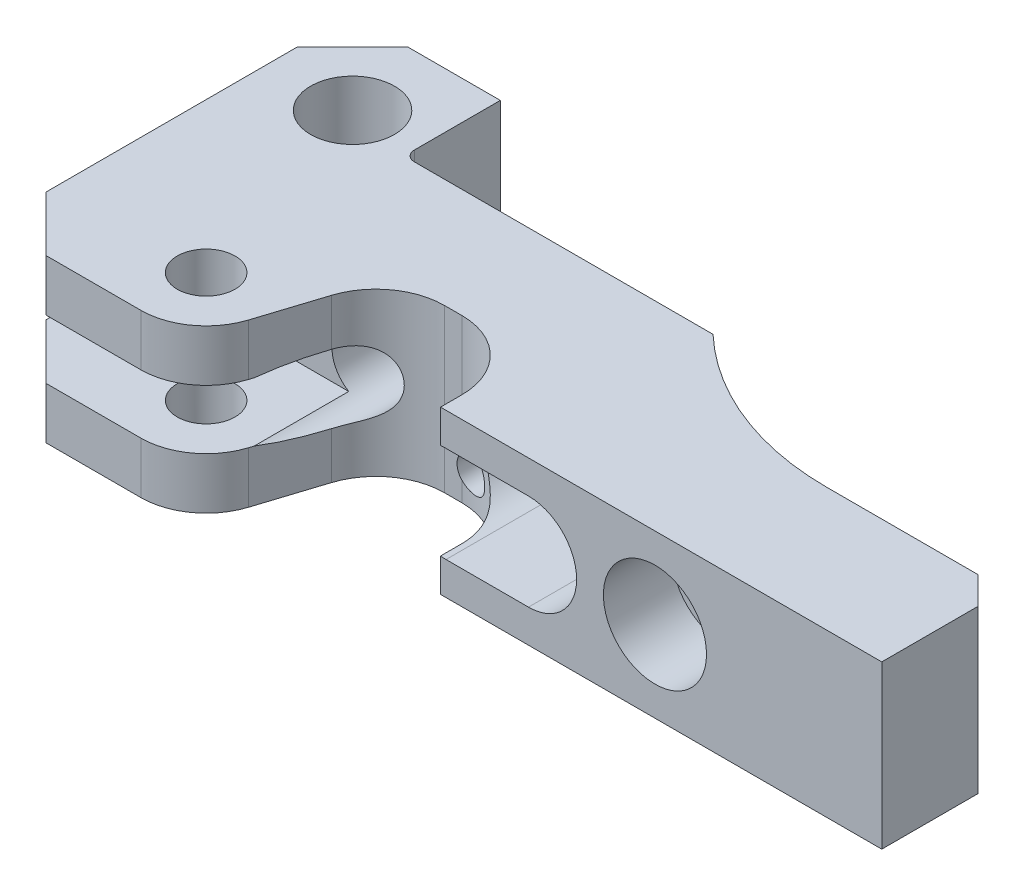
from build123d import *

# Parameters (mm, degrees)
CROQUIS1_R                 = 1.5
CROQUIS1_R_2               = 3.05
SALIENTE_EXTRUIR1_DEPTH    = 11.8
TALADRO_ROSCADO_M51_D      = 4.2
CROQUIS2_W                 = 10.5
CROQUIS2_H                 = 4.3
CORTAR_EXTRUIR1_DEPTH      = 18
CORTAR_EXTRUIR6_DEPTH      = 58.488085722
CORTAR_EXTRUIR6_DEPTH_BACK = 58.488085722
CROQUIS13_R                = 2.5
CROQUIS27_R                = 3.1
CORTAR_EXTRUIR8_DEPTH      = 10
CROQUIS31_R                = 3.75
CORTAR_EXTRUIR9_DEPTH      = 5
CORTAR_EXTRUIR12_DEPTH     = 59.884038604
CHAFL_N2_SIZE              = 4
CHAFL_N3_SIZE              = 2
CORTAR_EXTRUIR17_DEPTH     = 62.212172011
CROQUIS46_W                = 28.049554897
CROQUIS46_H                = 7
CORTAR_EXTRUIR18_DEPTH     = 59.884038604
TALADRO_ROSCADO_M31_D      = 2.5
TALADRO_ROSCADO_M31_DEPTH  = 8.5
REDONDEO2_R                = 0.75
CHAFL_N5_SIZE              = 0.6
CHAFL_N5_SIZE2             = 1.039230485
CHAFL_N6_SIZE              = 4


with BuildPart() as part:
    # Croquis1 → Saliente-Extruir1 (new body)
    with BuildSketch(Plane(origin=(0, 0, 0), x_dir=(1, 0, 0), z_dir=(0, 1, 0))):
        with BuildLine():
            Line((15.65, -8.95), (16.9, -8.95))
            ThreePointArc((16.9, -8.95), (20.435533906, -10.414466094), (21.9, -13.95))
            Line((21.9, -13.95), (21.9, -15.5))
            Line((21.9, -15.5), (54, -15.5))
            Line((54, -15.5), (54, 6))
            Line((54, 6), (-6, 6))
            Line((-6, 6), (-6, -20.3))
            Line((-6, -20.3), (4.9, -20.3))
            ThreePointArc((4.9, -20.3), (7.700168487, -19.386868052), (9.423737687, -16.998550083))
            Line((9.423737687, -16.998550083), (10.888170856, -12.425210439))
            ThreePointArc((10.888170856, -12.425210439), (12.702454225, -9.911191525), (15.65, -8.95))
        make_face()
        with Locations((4.9, -15.55)):
            Circle(CROQUIS1_R, mode=Mode.SUBTRACT)
        Circle(CROQUIS1_R_2, mode=Mode.SUBTRACT)
    extrude(amount=SALIENTE_EXTRUIR1_DEPTH)

    # Taladro roscado M51 (through all)
    with Locations(Plane(origin=(0, 11.8, 0), x_dir=(1, 0, 0), z_dir=(0, 1, 0))):
        with Locations((4.9, -15.55)):
            Hole(TALADRO_ROSCADO_M51_D / 2)

    # Croquis2 → Cortar-Extruir1 (cut)
    with BuildSketch(Plane.ZY.offset(6)):
        with Locations((15.05, 5.9)):
            Rectangle(CROQUIS2_W, CROQUIS2_H)
    extrude(amount=-CORTAR_EXTRUIR1_DEPTH, mode=Mode.SUBTRACT)

    # Croquis13 → Cortar-Extruir6 (cut, two sides: drawn at the far end of the back side and taken through both)
    with BuildSketch(Plane.XY.offset(9.8).offset(-CORTAR_EXTRUIR6_DEPTH_BACK)):
        with Locations((10.8, 5.9)):
            Circle(CROQUIS13_R)
    extrude(amount=CORTAR_EXTRUIR6_DEPTH + CORTAR_EXTRUIR6_DEPTH_BACK, mode=Mode.SUBTRACT)

    # Croquis27 → Cortar-Extruir8 (cut)
    with BuildSketch(Plane(origin=(0, 0, -6), x_dir=(-1, 0, 0), z_dir=(0, 0, -1))):
        with Locations((-10.8, 5.9)):
            Circle(CROQUIS27_R)
    extrude(amount=-CORTAR_EXTRUIR8_DEPTH, mode=Mode.SUBTRACT)

    # Croquis31 → Cortar-Extruir9 (cut)
    with BuildSketch(Plane.XY.offset(15.5)):
        with Locations((37.5, 5.9)):
            Circle(CROQUIS31_R)
    extrude(amount=-CORTAR_EXTRUIR9_DEPTH, mode=Mode.SUBTRACT)

    # Croquis34 → Cortar-Extruir12 (cut, through all)
    with BuildSketch(Plane.XZ):
        with BuildLine():
            Line((54, 6.5), (41, 6.5))
            ThreePointArc((41, 6.5), (29.819660113, 3.083123952), (22.459503782, -6))
            Line((22.459503782, -6), (54, -6))
            Line((54, -6), (54, 6.5))
        make_face()
    extrude(amount=-CORTAR_EXTRUIR12_DEPTH, mode=Mode.SUBTRACT)

    # Chaflán2
    chafl_n2_edges = [part.edges().sort_by_distance(p)[0] for p in [
        (-6, 5.9, -6),
    ]]
    chamfer(chafl_n2_edges, length=CHAFL_N2_SIZE)

    # Chaflán3
    chafl_n3_edges = [part.edges().sort_by_distance(p)[0] for p in [
        (54, 5.9, 6.5),
    ]]
    chamfer(chafl_n3_edges, length=CHAFL_N3_SIZE)

    # Croquis35 → Cortar-Revolución1 (revolve, cut)
    with BuildSketch(Plane(origin=(0, 5.9, 0), x_dir=(-1, 0, 0), z_dir=(0, -1, 0))):
        Polygon((-13.9, -4), (-10.8, -9.369357503), (-10.8, -4), align=None)
    revolve(axis=Axis((10.8, 5.9, 4), (0, 0, -1)), mode=Mode.SUBTRACT)

    # Croquis45 → Cortar-Extruir17 (cut, through all)
    with BuildSketch(Plane(origin=(0, 0, -6), x_dir=(-1, 0, 0), z_dir=(0, 0, -1))):
        with BuildLine():
            Line((-22.3, 2.4), (-28.3, 2.4))
            ThreePointArc((-28.3, 2.4), (-31.8, 5.9), (-28.3, 9.4))
            Line((-28.3, 9.4), (-22.3, 9.4))
            ThreePointArc((-22.3, 9.4), (-18.8, 5.9), (-22.3, 2.4))
        make_face()
    extrude(amount=-CORTAR_EXTRUIR17_DEPTH, mode=Mode.SUBTRACT)

    # Croquis46 → Cortar-Extruir18 (cut, through all)
    with BuildSketch(Plane.XZ):
        with Locations((18.774777449, -2.5)):
            Rectangle(CROQUIS46_W, CROQUIS46_H)
    extrude(amount=-CORTAR_EXTRUIR18_DEPTH, mode=Mode.SUBTRACT)

    # Taladro roscado M31
    with Locations(Plane(origin=(0, 0, 1), x_dir=(-1, 0, 0), z_dir=(0, 0, -1))):
        with Locations((-17.8, 2.3)):
            Hole(TALADRO_ROSCADO_M31_D / 2, depth=TALADRO_ROSCADO_M31_DEPTH)

    # Redondeo2
    redondeo2_edges = [part.edges().sort_by_distance(p)[0] for p in [
        (4.75, 5.9, 1),
    ]]
    fillet(redondeo2_edges, radius=REDONDEO2_R)

    # Chaflán5
    chafl_n5_edges = [part.edges().sort_by_distance(p)[0] for p in [
        (13.9, 5.9, 1),
    ]]
    chafl_n5_side = [part.faces().sort_by_distance(p)[0] for p in [
        (15.082931418, 6.005477059, 1),
    ]]
    chamfer(chafl_n5_edges, length=CHAFL_N5_SIZE, length2=CHAFL_N5_SIZE2, reference=chafl_n5_side[0])

    # Chaflán6
    chafl_n6_edges = [part.edges().sort_by_distance(p)[0] for p in [
        (-6, 9.925, 20.3),
        (-6, 1.875, 20.3),
    ]]
    chamfer(chafl_n6_edges, length=CHAFL_N6_SIZE)


solid = part.part
